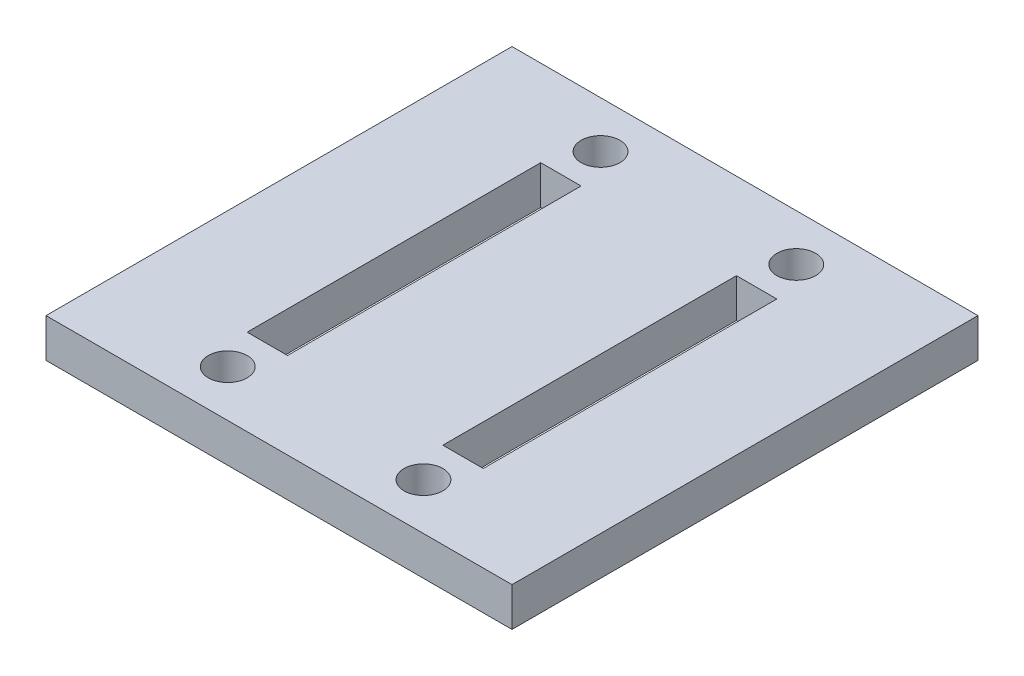
from build123d import *

# Parameters (mm, degrees)
SKETCH1_W           = 76.2
SKETCH1_H           = 76.2
BOSS_EXTRUDE1_DEPTH = 6.35
SKETCH2_W           = 6.604
SKETCH2_H           = 48.006
CUT_EXTRUDE1_DEPTH  = 55.254423783
SKETCH3_R           = 3.175
CUT_EXTRUDE3_DEPTH  = 55.254423783


with BuildPart() as part:
    # Sketch1 → Boss-Extrude1 (new body)
    with BuildSketch(Plane(origin=(0, 0, 0), x_dir=(1, 0, 0), z_dir=(0, 1, 0))):
        Rectangle(SKETCH1_W, SKETCH1_H)
    extrude(amount=BOSS_EXTRUDE1_DEPTH)

    # Sketch2 → Cut-Extrude1 (cut, through all)
    with BuildSketch(Plane(origin=(0, 0, 0), x_dir=(1, 0, 0), z_dir=(0, 1, 0))):
        with Locations((16.002, 0)):
            Rectangle(SKETCH2_W, SKETCH2_H)
        with Locations((-16.002, 0)):
            Rectangle(SKETCH2_W, SKETCH2_H)
    extrude(amount=CUT_EXTRUDE1_DEPTH, mode=Mode.SUBTRACT)

    # Sketch3 → Cut-Extrude3 (cut, through all)
    with BuildSketch(Plane(origin=(0, 0, 0), x_dir=(1, 0, 0), z_dir=(0, 1, 0))):
        with Locations(Location((-16.002, 30.48, 0), (0, 0, 270))):
            Circle(SKETCH3_R)
        with Locations(Location((-16.002, -30.48, 0), (0, 0, 90))):
            Circle(SKETCH3_R)
        with Locations(Location((16.002, -30.48, 0), (0, 0, 270))):
            Circle(SKETCH3_R)
        with Locations(Location((16.002, 30.48, 0), (0, 0, 90))):
            Circle(SKETCH3_R)
    extrude(amount=CUT_EXTRUDE3_DEPTH, mode=Mode.SUBTRACT)


solid = part.part
